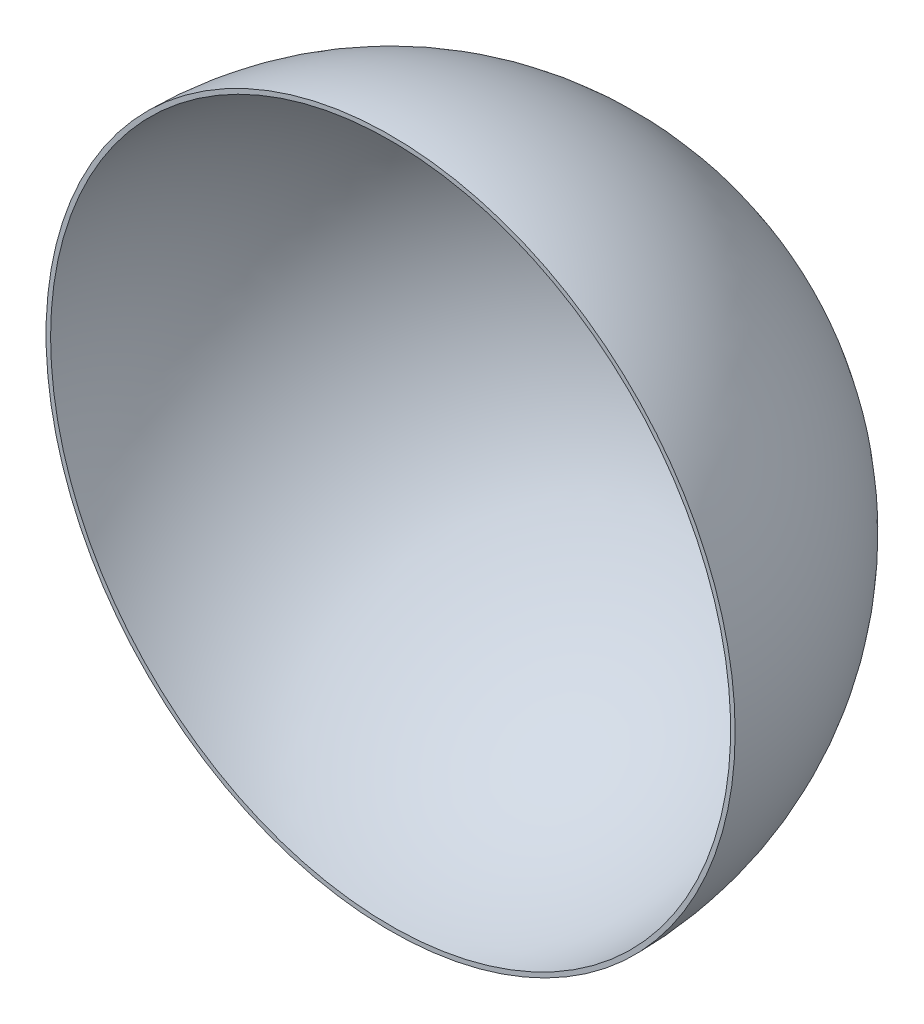
from build123d import *

# Parameters (mm, degrees)
REVOLVE_THIN1_ANGLE = 180


with BuildPart() as part:
    # Sketch2 → Revolve-Thin1 (revolve)
    with BuildSketch(Plane.XY):
        with BuildLine():
            ThreePointArc((0, 380), (380, 0), (0, -380))
            Line((0, -380), (0, -375))
            ThreePointArc((0, -375), (375, 0), (0, 375))
            Line((0, 375), (0, 380))
        make_face()
    revolve(axis=Axis((0, -1000, 0), (0, 1, 0)), revolution_arc=REVOLVE_THIN1_ANGLE)


solid = part.part
